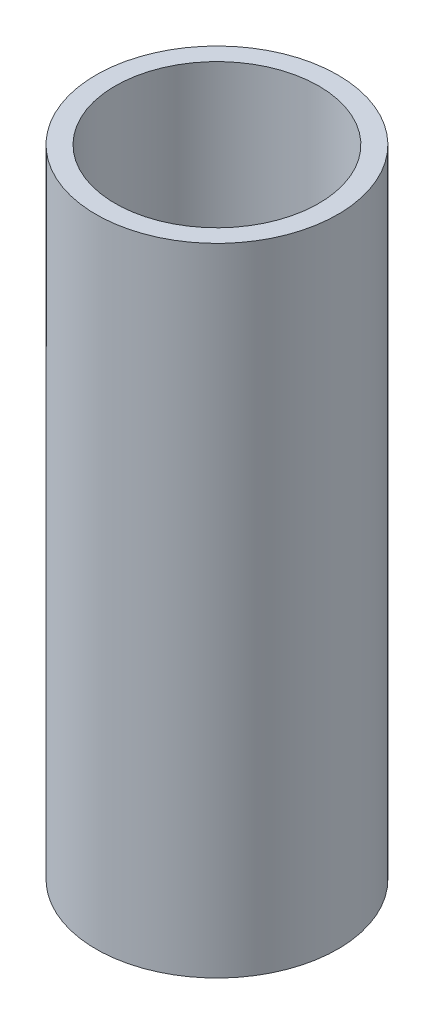
from build123d import *

# Parameters (mm, degrees)
SKETCH_1_W = 3
SKETCH_1_H = 100


with BuildPart() as part:
    # Эскиз1 → Повернуть1 (revolve)
    with BuildSketch(Plane.XY, mode=Mode.PRIVATE) as revolve_1_sk:
        with Locations((-17.5, 50)):
            Rectangle(SKETCH_1_W, SKETCH_1_H)
    revolve(revolve_1_sk.sketch.rotate(Axis((0, 0, 0), (0, 1, 0)), 270), axis=Axis((0, 0, 0), (0, 1, 0)))


solid = part.part
